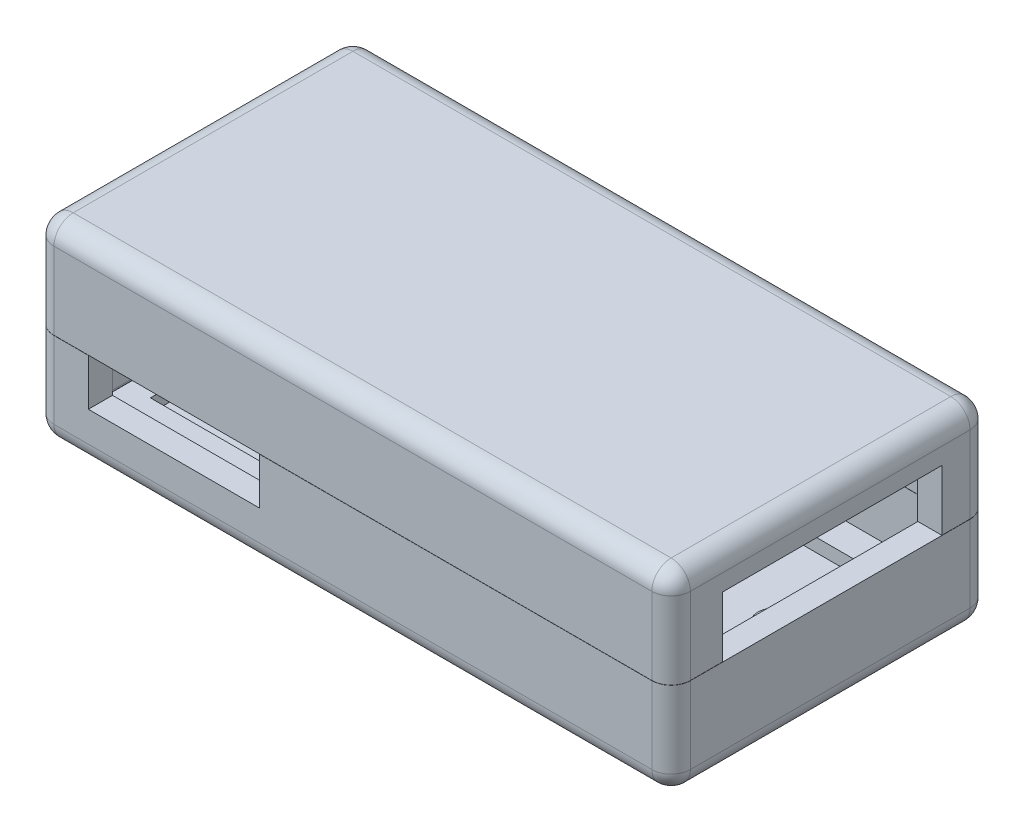
from build123d import *

# Parameters (mm, degrees)
SKETCH1_W           = 83.82
SKETCH1_H           = 41.91
BOSS_EXTRUDE1_DEPTH = 25.4
SKETCH2_W           = 22.5679
SKETCH2_H           = 6.14934
CUT_EXTRUDE1_DEPTH  = 65.482991556
SHELL1_T            = -3.175
CUT_EXTRUDE3_REACH  = 92.056
SKETCH4_W           = 7.366
SKETCH4_H           = 6.14934
FILLET1_R           = 2.54
SKETCH5_W           = 89.038189856
SKETCH5_H           = 0.0254
CUT_EXTRUDE4_DEPTH  = 65.482991556
SKETCH6_W           = 77.47
SKETCH6_H           = 35.56
BOSS_EXTRUDE2_DEPTH = 1.75006
SKETCH7_R           = 2.54
SKETCH7_R_2         = 0.635
BOSS_EXTRUDE3_DEPTH = 1.6002
SKETCH8_W           = 14.097
SKETCH8_H           = 3.175
BOSS_EXTRUDE4_DEPTH = 3.81
FILLET2_R           = 0.508
SKETCH9_W           = 28.870221249
SKETCH9_H           = 7.968851024
CUT_EXTRUDE5_DEPTH  = 3.175


with BuildPart() as part:
    # Sketch1 → Boss-Extrude1 (new body)
    with BuildSketch(Plane(origin=(0, 0, 0), x_dir=(1, 0, 0), z_dir=(0, 1, 0))):
        Rectangle(SKETCH1_W, SKETCH1_H)
    extrude(amount=BOSS_EXTRUDE1_DEPTH)

    # Sketch2 → Cut-Extrude1 (cut, through all)
    with BuildSketch(Plane.XY.offset(20.955)):
        with Locations((-23.55215, 9.59993)):
            Rectangle(SKETCH2_W, SKETCH2_H)
    extrude(amount=-CUT_EXTRUDE1_DEPTH, mode=Mode.SUBTRACT)

    # Shell1
    shell1_openings = [part.faces().sort_by_distance(p)[0] for p in [
        (-34.8361, 9.59993, 0),
        (-23.55215, 12.6746, 0),
        (-12.2682, 9.59993, 0),
        (-23.55215, 6.52526, 0),
    ]]
    offset(amount=SHELL1_T, openings=shell1_openings, kind=Kind.INTERSECTION)

    # Sketch4 → Cut-Extrude3 (cut, up to next)
    with BuildSketch(Plane.ZY.offset(41.91), mode=Mode.PRIVATE) as cut_extrude3_sk1:
        with Locations((0, 9.59993)):
            Rectangle(SKETCH4_W, SKETCH4_H)
    cut_extrude3_tool1 = extrude(cut_extrude3_sk1.sketch, amount=-CUT_EXTRUDE3_REACH, mode=Mode.PRIVATE) & part.part
    add(cut_extrude3_tool1.solids().sort_by_distance((-41.91, 9.59993, 0))[0], mode=Mode.SUBTRACT)

    # Fillet1
    fillet1_edges = [part.edges().sort_by_distance(p)[0] for p in [
        (0, 25.4, -20.955),
        (-41.91, 25.4, 0),
        (0, 25.4, 20.955),
        (-41.91, 0, 0),
        (0, 0, -20.955),
        (41.91, 0, 0),
        (0, 0, 20.955),
        (-41.91, 12.7, 20.955),
        (-41.91, 12.7, -20.955),
        (41.91, 12.7, -20.955),
        (41.91, 12.7, 20.955),
        (41.91, 25.4, 0),
    ]]
    fillet(fillet1_edges, radius=FILLET1_R)

    # Sketch5 → Cut-Extrude4 (cut, through all)
    with BuildSketch(Plane.XY.offset(20.955)):
        with Locations((0.216743403, 12.6873)):
            Rectangle(SKETCH5_W, SKETCH5_H)
    extrude(amount=-CUT_EXTRUDE4_DEPTH, mode=Mode.SUBTRACT)


with BuildPart() as cut_extrude4_piece_1:
    # of the separate pieces the step leaves, piece 1, a body of its own (cut_extrude4_pieces)
    add(part.part.solids().sort_by_distance((-39.37, 12.7, 20.955))[0])

    # Sketch9 → Cut-Extrude5 (cut)
    with BuildSketch(Plane(origin=(41.91, 0, 0), x_dir=(0, 0, -1), z_dir=(1, 0, 0))):
        with Locations((0.260092084, 16.684425512)):
            Rectangle(SKETCH9_W, SKETCH9_H)
    extrude(amount=-CUT_EXTRUDE5_DEPTH, mode=Mode.SUBTRACT)


with BuildPart() as cut_extrude4_piece_2:
    # of the separate pieces the step leaves, piece 2, a body of its own (cut_extrude4_pieces)
    add(part.part.solids().sort_by_distance((-39.37, 2.54, 20.955))[0])

    # Sketch6 → Boss-Extrude2 (add)
    with BuildSketch(Plane(origin=(0, 3.175, 0), x_dir=(1, 0, 0), z_dir=(0, 1, 0))):
        Rectangle(SKETCH6_W, SKETCH6_H)
        Polygon((-33.655, -13.97), (-33.655, 13.97), (34.925, 13.97), (34.925, 6.35), (31.369, 6.35), (31.369, -6.35), (34.925, -6.35), (34.925, -13.97), align=None, mode=Mode.SUBTRACT)
    extrude(amount=BOSS_EXTRUDE2_DEPTH)

    # Sketch7 → Boss-Extrude3 (add)
    with BuildSketch(Plane(origin=(0, 4.92506, 0), x_dir=(1, 0, 0), z_dir=(0, 1, 0))):
        with Locations(Location((34.925, 0, 0), (0, 0, 90))):
            Circle(SKETCH7_R)
        with Locations(Location((34.925, 0, 0), (0, 0, 270))):
            Circle(SKETCH7_R_2, mode=Mode.SUBTRACT)
    extrude(amount=BOSS_EXTRUDE3_DEPTH)

    # Sketch8 → Boss-Extrude4 (add)
    with BuildSketch(Plane(origin=(-38.735, 0, 0), x_dir=(0, 0, -1), z_dir=(1, 0, 0))):
        with Locations((-10.7315, 8.11276)):
            Rectangle(SKETCH8_W, SKETCH8_H)
        with Locations((10.7315, 8.11276)):
            Rectangle(SKETCH8_W, SKETCH8_H)
    extrude(amount=BOSS_EXTRUDE4_DEPTH)

    # Fillet2
    fillet2_edges = [cut_extrude4_piece_2.edges().sort_by_distance(p)[0] for p in [
        (-34.925, 6.52526, 10.7315),
        (-34.925, 6.52526, -10.7315),
    ]]
    fillet(fillet2_edges, radius=FILLET2_R)


solid = Compound([cut_extrude4_piece_1.part, cut_extrude4_piece_2.part])
